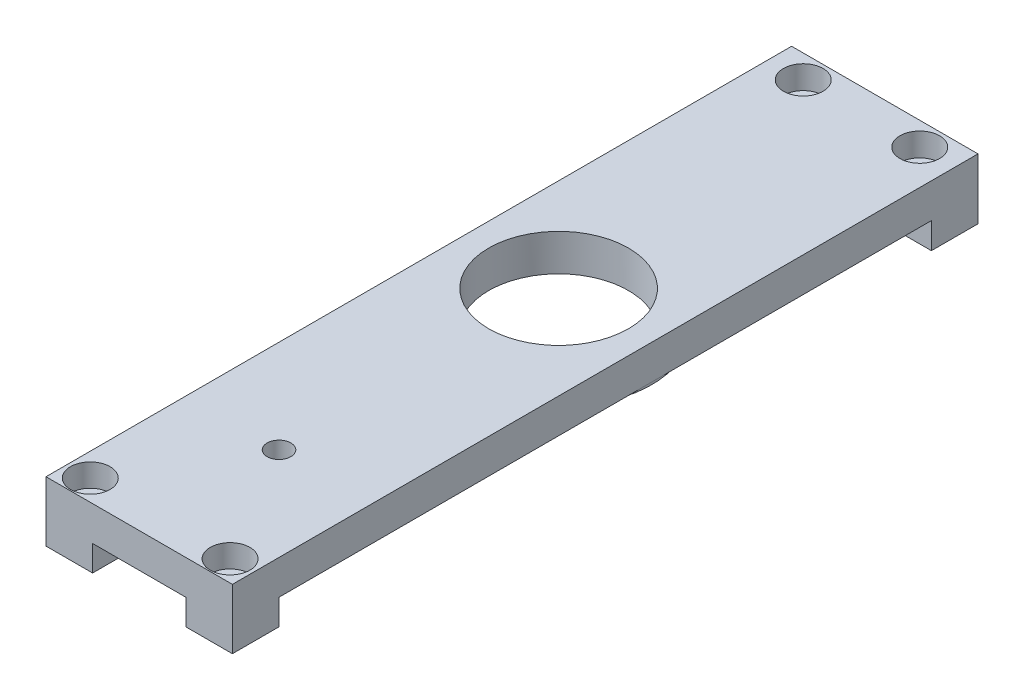
from build123d import *

# Parameters (mm, degrees)
SKIZZE1_W                            = 40
SKIZZE1_H                            = 13
AUFSATZ_LINEAR_AUSTRAGEN1_DEPTH      = 10
SKIZZE3_W                            = 40
SKIZZE3_H                            = 7.4
AUFSATZ_LINEAR_AUSTRAGEN3_DEPTH      = 150
SCHNITT_LINEAR_AUSTRAGEN1_DEPTH      = 166.090157187
SCHNITT_LINEAR_AUSTRAGEN1_DEPTH_BACK = 11
SKIZZE4_R                            = 15
SKIZZE7_R                            = 20
AUFSATZ_LINEAR_AUSTRAGEN4_DEPTH      = 0.5
SKIZZE5_R                            = 2.55
SCHNITT_LINEAR_AUSTRAGEN2_DEPTH      = 150
SCHNITT_LINEAR_START                 = -0.5
SKIZZE8_R                            = 15
SCHNITT_LINEAR_AUSTRAGEN4_DEPTH      = 0.5
SKIZZE10_R                           = 2.5
SCHNITT_LINEAR_AUSTRAGEN5_DEPTH      = 17
SKIZZE15_R                           = 4.25
SCHNITT_LINEAR_AUSTRAGEN7_DEPTH      = 5
SKIZZE16_W                           = 10
SKIZZE16_H                           = 10
AUFSATZ_LINEAR_AUSTRAGEN5_DEPTH      = 5.5
SKIZZE17_R                           = 2.5
SCHNITT_LINEAR_AUSTRAGEN8_DEPTH      = 21.6
SKIZZE18_R                           = 4.25
SCHNITT_LINEAR_AUSTRAGEN9_DEPTH      = 4.9


with BuildPart() as part:
    # Skizze1 → Aufsatz-Linear austragen1 (new body)
    with BuildSketch(Plane.XY):
        with Locations((20, 6.5)):
            Rectangle(SKIZZE1_W, SKIZZE1_H)
    extrude(amount=AUFSATZ_LINEAR_AUSTRAGEN1_DEPTH)

    # Skizze3 → Aufsatz-Linear austragen3 (add)
    with BuildSketch(Plane.XY.offset(10)):
        with Locations((20, 9.3)):
            Rectangle(SKIZZE3_W, SKIZZE3_H)
    extrude(amount=AUFSATZ_LINEAR_AUSTRAGEN3_DEPTH)

    # Skizze4 → Schnitt-Linear austragen1 (cut, two sides: drawn at the far end of the back side and taken through both)
    with BuildSketch(Plane.XZ.offset(-5.6).offset(-SCHNITT_LINEAR_AUSTRAGEN1_DEPTH_BACK)):
        with Locations(Location((20, 70, 0), (0, 0, 90))):
            Circle(SKIZZE4_R)
    extrude(amount=SCHNITT_LINEAR_AUSTRAGEN1_DEPTH + SCHNITT_LINEAR_AUSTRAGEN1_DEPTH_BACK, mode=Mode.SUBTRACT)

    # Skizze7 → Aufsatz-Linear austragen4 (add)
    with BuildSketch(Plane.XZ.offset(-5.6)):
        with Locations(Location((20, 70, 0), (0, 0, 180))):
            Circle(SKIZZE7_R)
    extrude(amount=AUFSATZ_LINEAR_AUSTRAGEN4_DEPTH)

    # Skizze5 → Schnitt-Linear austragen2 (cut)
    with BuildSketch(Plane(origin=(0, 5.6, 0), x_dir=(-1, 0, 0), z_dir=(0, -1, 0))):
        with Locations(Location((-20, -130, 0), (0, 0, 90))):
            Circle(SKIZZE5_R)
    extrude(amount=-SCHNITT_LINEAR_AUSTRAGEN2_DEPTH, mode=Mode.SUBTRACT)

    # Skizze8 → Schnitt-Linear austragen4 (cut)
    with BuildSketch(Plane(origin=(0, 5.6, 0), x_dir=(1, 0, 0), z_dir=(0, 1, 0)).offset(SCHNITT_LINEAR_START)):
        with Locations(Location((20, -70, 0), (0, 0, 270))):
            Circle(SKIZZE8_R)
    extrude(amount=SCHNITT_LINEAR_AUSTRAGEN4_DEPTH, mode=Mode.SUBTRACT)

    # Skizze10 → Schnitt-Linear austragen5 (cut)
    with BuildSketch(Plane.XZ):
        with Locations(Location((7.5, 5, 0), (0, 0, 270))):
            Circle(SKIZZE10_R)
        with Locations(Location((32.5, 5, 0), (0, 0, 270))):
            Circle(SKIZZE10_R)
    extrude(amount=-SCHNITT_LINEAR_AUSTRAGEN5_DEPTH, mode=Mode.SUBTRACT)

    # Skizze15 → Schnitt-Linear austragen7 (cut)
    with BuildSketch(Plane(origin=(0, 13, 0), x_dir=(1, 0, 0), z_dir=(0, 1, 0))):
        with Locations(Location((7.5, -5, 0), (0, 0, 270))):
            Circle(SKIZZE15_R)
        with Locations(Location((32.5, -5, 0), (0, 0, 270))):
            Circle(SKIZZE15_R)
    extrude(amount=-SCHNITT_LINEAR_AUSTRAGEN7_DEPTH, mode=Mode.SUBTRACT)

    # Skizze16 → Aufsatz-Linear austragen5 (add)
    with BuildSketch(Plane.XZ.offset(-5.6)):
        with Locations((5, 155)):
            Rectangle(SKIZZE16_W, SKIZZE16_H)
        with Locations((35, 155)):
            Rectangle(SKIZZE16_W, SKIZZE16_H)
    extrude(amount=AUFSATZ_LINEAR_AUSTRAGEN5_DEPTH)

    # Skizze17 → Schnitt-Linear austragen8 (cut)
    with BuildSketch(Plane(origin=(0, 13, 0), x_dir=(1, 0, 0), z_dir=(0, 1, 0))):
        with Locations(Location((5, -155.5, 0), (0, 0, 270))):
            Circle(SKIZZE17_R)
        with Locations(Location((35, -155.5, 0), (0, 0, 270))):
            Circle(SKIZZE17_R)
    extrude(amount=-SCHNITT_LINEAR_AUSTRAGEN8_DEPTH, mode=Mode.SUBTRACT)

    # Skizze18 → Schnitt-Linear austragen9 (cut)
    with BuildSketch(Plane(origin=(0, 13, 0), x_dir=(1, 0, 0), z_dir=(0, 1, 0))):
        with Locations(Location((5, -155.5, 0), (0, 0, 270))):
            Circle(SKIZZE18_R)
        with Locations(Location((35, -155.5, 0), (0, 0, 270))):
            Circle(SKIZZE18_R)
    extrude(amount=-SCHNITT_LINEAR_AUSTRAGEN9_DEPTH, mode=Mode.SUBTRACT)


solid = part.part
